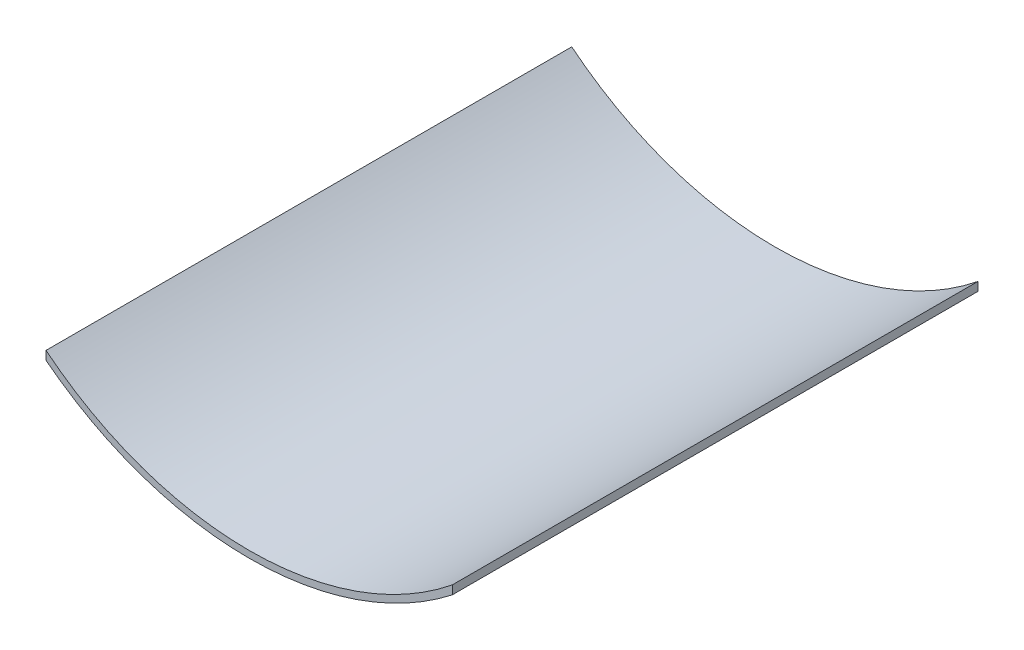
from build123d import *

# Parameters (mm, degrees)
BOSS_EXTRUDE1_DEPTH = 440


with BuildPart() as part:
    # Sketch1 → Boss-Extrude1 (new body)
    with BuildSketch(Plane.XY):
        with BuildLine():
            Line((-206.401092582, 77.855519445), (-206.401092582, 70.618502369))
            ThreePointArc((-206.401092582, 70.618502369), (-36.401092582, 12.184462709), (133.598907418, 70.618502369))
            Line((133.598907418, 70.618502369), (133.598907418, 77.855519445))
            ThreePointArc((133.598907418, 77.855519445), (-36.401092582, 17.855519445), (-206.401092582, 77.855519445))
        make_face()
    extrude(amount=BOSS_EXTRUDE1_DEPTH)


solid = part.part
